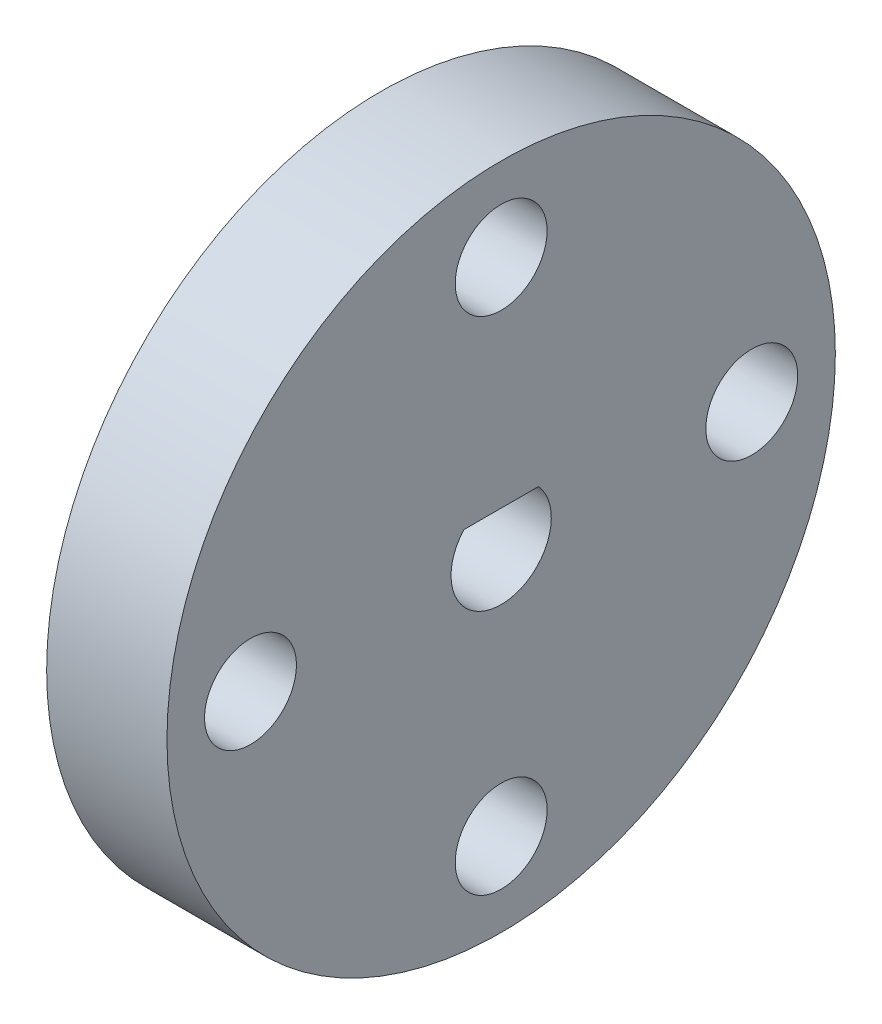
from build123d import *

# Parameters (mm, degrees)
ESBO_O1_W               = 7.2
ESBO_O1_H               = 20
CORTE_EXTRUS_O2_DEPTH   = 30.186298155
FURO_COM_FOLGA_DE_M51_D = 5.5


with BuildPart() as part:
    # Esboço1 → Revolução1 (revolve)
    with BuildSketch(Plane.XY, mode=Mode.PRIVATE) as revolu_o1_sk:
        with Locations((3.6, 10)):
            Rectangle(ESBO_O1_W, ESBO_O1_H)
    revolve(revolu_o1_sk.sketch.rotate(Axis((-35, 0, 0), (1, 0, 0)), 90), axis=Axis((-35, 0, 0), (1, 0, 0)))

    # Esboço3 → Corte-extrusão2 (cut, through all)
    with BuildSketch(Plane(origin=(7.2, 0, 0), x_dir=(0, 0, -1), z_dir=(1, 0, 0))):
        with BuildLine():
            Line((-2.236067977, 2), (2.236067977, 2))
            ThreePointArc((2.236067977, 2), (0, -3), (-2.236067977, 2))
        make_face()
    extrude(amount=-CORTE_EXTRUS_O2_DEPTH, mode=Mode.SUBTRACT)

    # Furo com folga de M51 (through all)
    with Locations(Plane(origin=(7.2, 0, 0), x_dir=(0, 0, -1), z_dir=(1, 0, 0))):
        with Locations((0, 15), (15, 0), (0, -15), (-15, 0)):
            Hole(FURO_COM_FOLGA_DE_M51_D / 2)


solid = part.part
